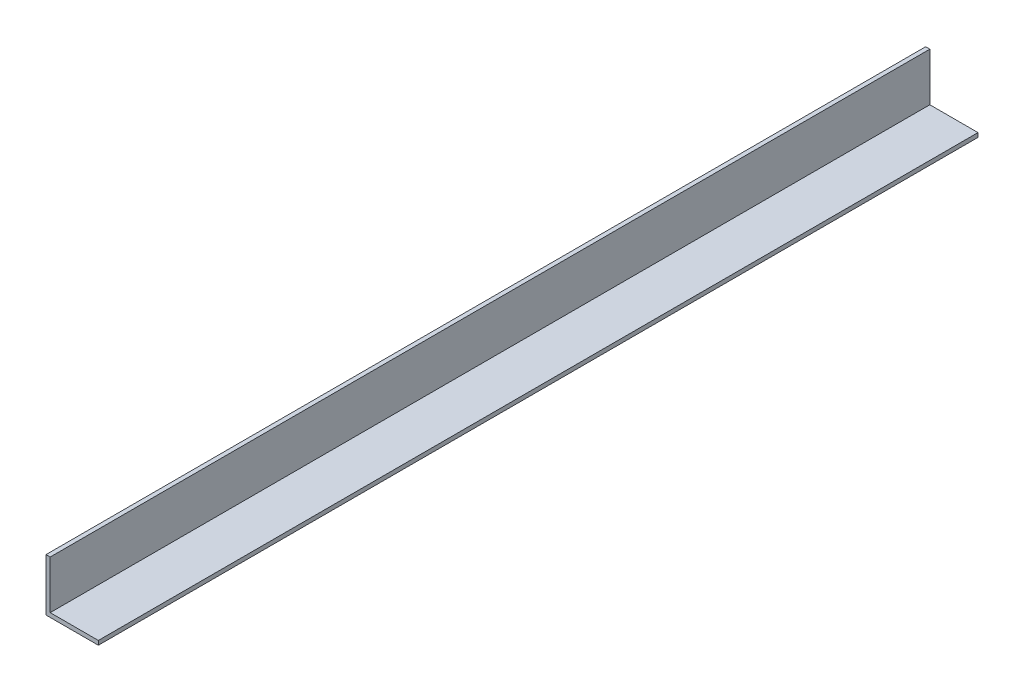
from build123d import *

# Parameters (mm, degrees)
BOSS_EXTRUDE1_DEPTH = 840


with BuildPart() as part:
    # Sketch1 → Boss-Extrude1 (new body)
    with BuildSketch(Plane.XY):
        Polygon((-36.613103873, 18.123830156), (-36.613103873, -27.876169844), (9.386896127, -27.876169844), (9.386896127, -31.876169844), (-40.613103873, -31.876169844), (-40.613103873, 18.123830156), align=None)
    extrude(amount=BOSS_EXTRUDE1_DEPTH)


solid = part.part
